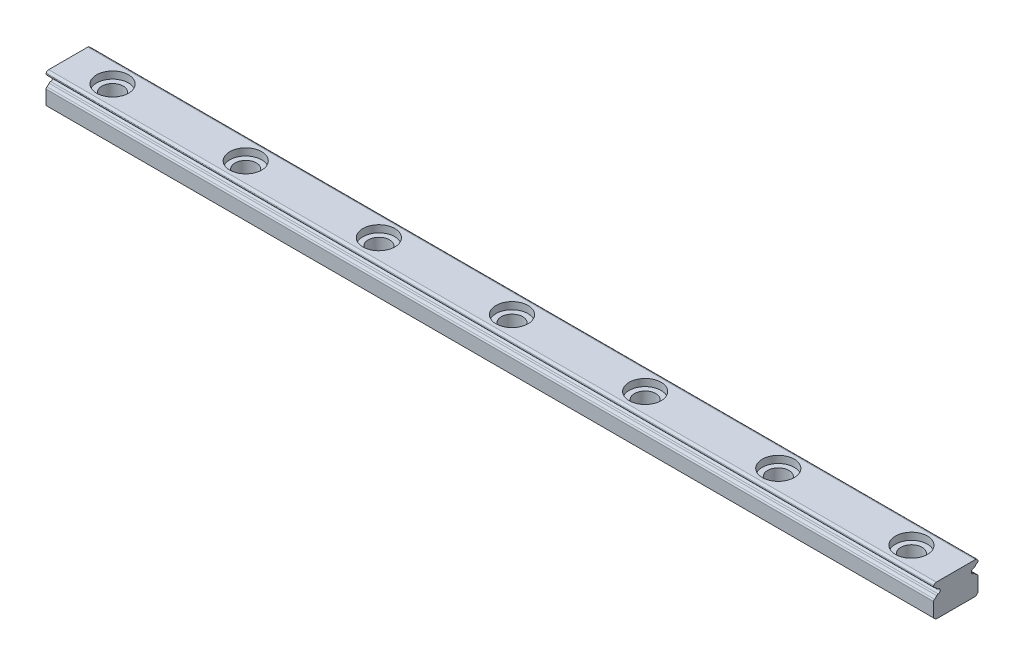
from build123d import *

# Parameters (mm, degrees)
SKETCH_1_W             = 5
SKETCH_1_H             = 3.6
EXTRUDE_1_DEPTH        = 50
CUT_EXTRUDE_1_DEPTH    = 101.047438748
SKETCH_3_R             = 1.79995
CUT_EXTRUDE_2_DEPTH    = 0.8
SKETCH_4_R             = 1.2
CUT_EXTRUDE_3_DEPTH    = 51.140702029
FILLET_1_R             = 0.3
FILLET_2_R             = 0.2
CHAMFER_1_SIZE         = 0.25
PATTERN_LINEAR_1_COUNT = 7
PATTERN_LINEAR_1_PITCH = 15


with BuildPart() as part:
    # 草图1 → 凸台-拉伸1 (new, symmetric)
    with BuildSketch(Plane(origin=(0, 0, 0), x_dir=(0, 0, -1), z_dir=(1, 0, 0))):
        Rectangle(SKETCH_1_W, SKETCH_1_H)
    extrude(amount=EXTRUDE_1_DEPTH, both=True)

    # 草图2 → 切除-拉伸1 (cut, through all)
    with BuildSketch(Plane(origin=(50, 0, 0), x_dir=(0, 0, -1), z_dir=(1, 0, 0))):
        with BuildLine():
            Line((2.5, 1.4), (2.5, 0.184))
            ThreePointArc((2.5, 0.184), (2.260324923, 0.318670305), (2.1, 0.542))
            Line((2.1, 0.542), (2, 0.542))
            ThreePointArc((2, 0.542), (1.75, 0.792), (2, 1.042))
            Line((2, 1.042), (2.1, 1.042))
            ThreePointArc((2.1, 1.042), (2.260324923, 1.265329695), (2.5, 1.4))
        make_face()
        with BuildLine():
            Line((-2.1, 1.042), (-2, 1.042))
            ThreePointArc((-2, 1.042), (-1.75, 0.792), (-2, 0.542))
            Line((-2, 0.542), (-2.1, 0.542))
            ThreePointArc((-2.1, 0.542), (-2.260324923, 0.318670305), (-2.5, 0.184))
            Line((-2.5, 0.184), (-2.5, 1.4))
            ThreePointArc((-2.5, 1.4), (-2.260324923, 1.265329695), (-2.1, 1.042))
        make_face()
    extrude(amount=-CUT_EXTRUDE_1_DEPTH, mode=Mode.SUBTRACT)

    # 草图3 → 切除-拉伸2 (cut)
    with BuildSketch(Plane(origin=(0, 1.8, 0), x_dir=(1, 0, 0), z_dir=(0, 1, 0))):
        with Locations(Location((-45, 0, 0), (0, 0, 270))):
            Circle(SKETCH_3_R)
    cut_extrude_2 = extrude(amount=-CUT_EXTRUDE_2_DEPTH, mode=Mode.SUBTRACT)

    # 草图4 → 切除-拉伸3 (cut, through all)
    with BuildSketch(Plane(origin=(0, 1, 0), x_dir=(1, 0, 0), z_dir=(0, 1, 0))):
        with Locations(Location((-45, 0, 0), (0, 0, 270))):
            Circle(SKETCH_4_R)
    cut_extrude_3 = extrude(amount=-CUT_EXTRUDE_3_DEPTH, mode=Mode.SUBTRACT)

    # 圆角1
    fillet_1_edges = [part.edges().sort_by_distance(p)[0] for p in [
        (0, 1.8, 2.5),
        (0, 1.8, -2.5),
    ]]
    fillet(fillet_1_edges, radius=FILLET_1_R)

    # 圆角2
    fillet_2_edges = [part.edges().sort_by_distance(p)[0] for p in [
        (0, 1.4, -2.5),
        (0, 1.042, -2.1),
        (0, 0.542, -2.1),
        (0, 0.184, -2.5),
        (0, 0.184, 2.5),
        (0, 1.4, 2.5),
        (0, 1.042, 2.1),
        (0, 0.542, 2.1),
    ]]
    fillet(fillet_2_edges, radius=FILLET_2_R)

    # 倒角1
    chamfer_1_edges = [part.edges().sort_by_distance(p)[0] for p in [
        (0, -1.8, -2.5),
        (0, -1.8, 2.5),
    ]]
    chamfer(chamfer_1_edges, length=CHAMFER_1_SIZE)

    # 阵列(线性)1: 切除-拉伸2, 切除-拉伸3 ×7
    with Locations(*[(i * PATTERN_LINEAR_1_PITCH, 0, 0) for i in range(1, PATTERN_LINEAR_1_COUNT)]):
        add(cut_extrude_2, mode=Mode.SUBTRACT)
        add(cut_extrude_3, mode=Mode.SUBTRACT)


solid = part.part
